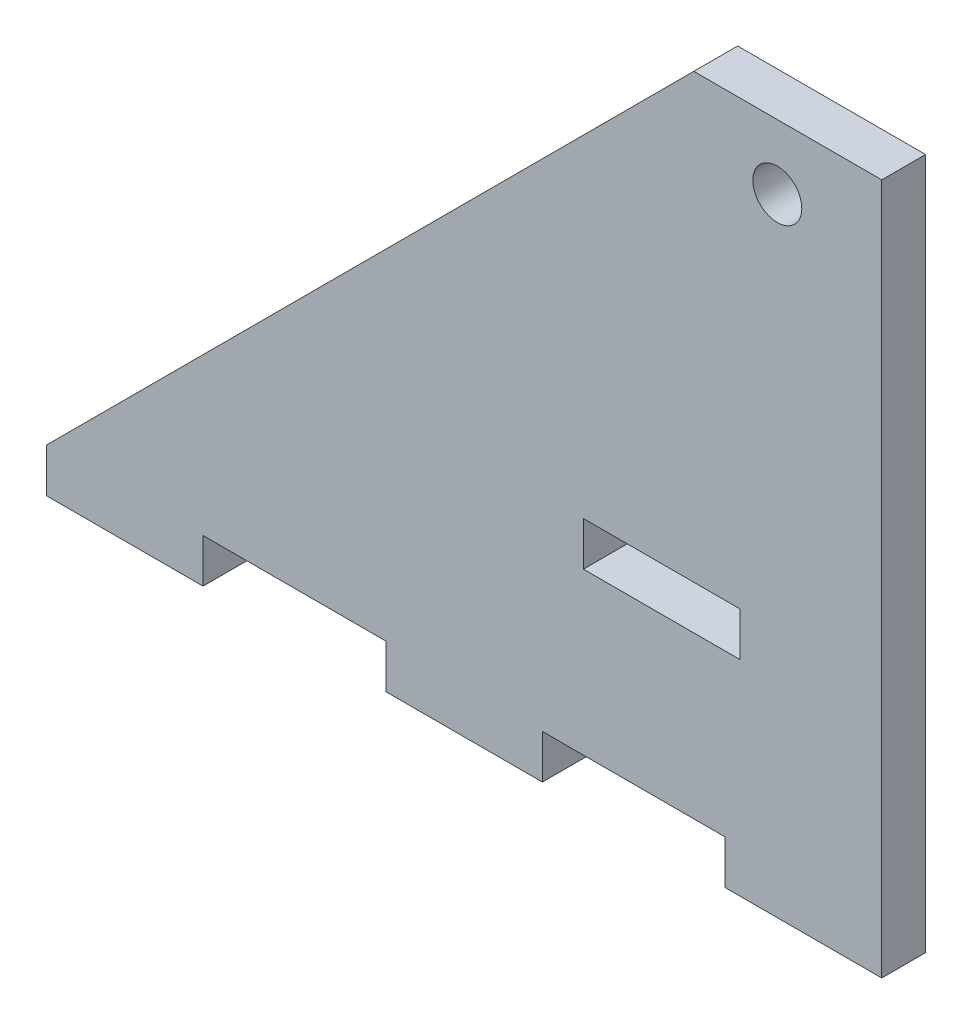
from build123d import *

# Parameters (mm, degrees)
BASE_DEPTH         = 5.334
SKETCH2_R          = 2.975
SKETCH2_W          = 19.05
SKETCH2_H          = 5.334
MOUNT_POINTS_DEPTH = 129.650686574
SKETCH3_W          = 19.05
SKETCH3_H          = 5.334
TABS_DEPTH         = 5.334


with BuildPart() as part:
    # Sketch1 → Base (new body)
    with BuildSketch(Plane.XY):
        Polygon((78.74, 78.74), (0, 0), (101.6, 0), (101.6, 78.74), align=None)
    extrude(amount=BASE_DEPTH)

    # Sketch2 → Mount Points (cut, through all)
    with BuildSketch(Plane.XY.offset(5.334)):
        with Locations((88.9, 70.866)):
            Circle(SKETCH2_R)
        with Locations((74.84, 22.256365646)):
            Rectangle(SKETCH2_W, SKETCH2_H)
    extrude(amount=-MOUNT_POINTS_DEPTH, mode=Mode.SUBTRACT)

    # Sketch3 → Tabs (add)
    with BuildSketch(Plane.XZ):
        with Locations((9.525, 2.667)):
            Rectangle(SKETCH3_W, SKETCH3_H)
        with Locations((92.075, 2.667)):
            Rectangle(SKETCH3_W, SKETCH3_H)
        with Locations((50.8, 2.667)):
            Rectangle(SKETCH3_W, SKETCH3_H)
    extrude(amount=TABS_DEPTH)


solid = part.part
